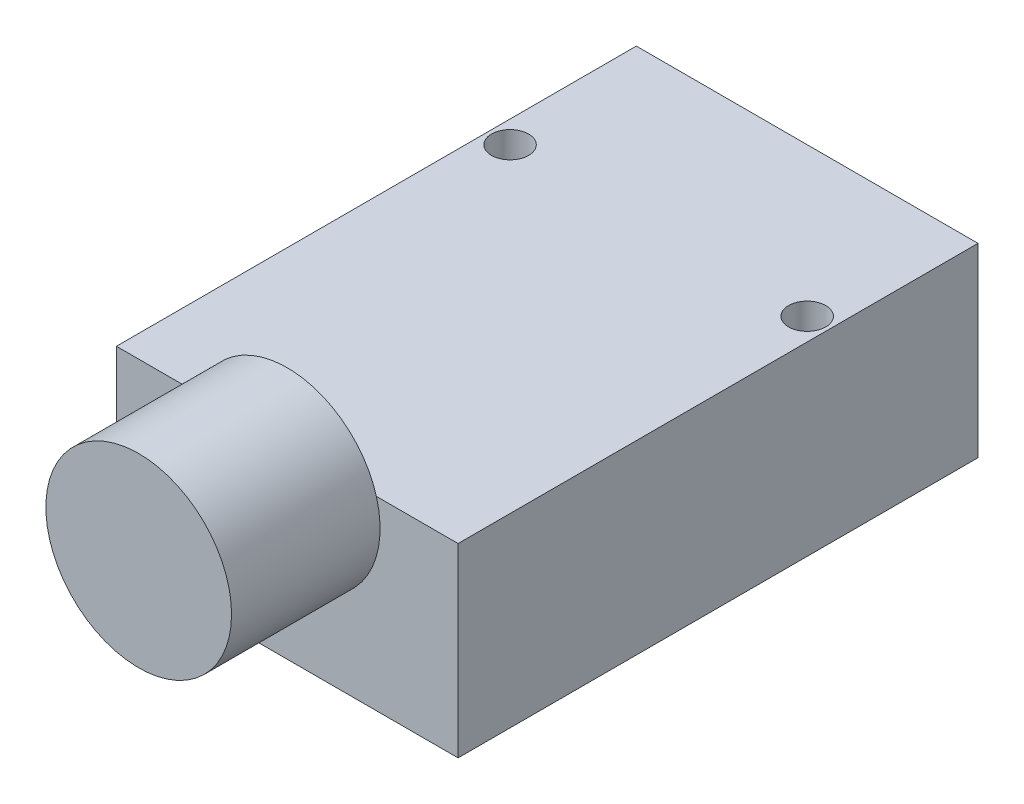
from build123d import *

# Parameters (mm, degrees)
SKETCH1_W           = 46
SKETCH1_H           = 70
BOSS_EXTRUDE1_DEPTH = 25
SKETCH2_R           = 12.5
BOSS_EXTRUDE2_DEPTH = 20
CUT_EXTRUDE1_REACH  = 89.413
SKETCH3_R           = 2.5


with BuildPart() as part:
    # Sketch1 → Boss-Extrude1 (new body)
    with BuildSketch(Plane(origin=(0, 0, 0), x_dir=(1, 0, 0), z_dir=(0, 1, 0))):
        with Locations((23, 35)):
            Rectangle(SKETCH1_W, SKETCH1_H)
    extrude(amount=BOSS_EXTRUDE1_DEPTH)

    # Sketch2 → Boss-Extrude2 (add)
    with BuildSketch(Plane.XY):
        with Locations(Location((23, 21.5, 0), (0, 0, 163.739795292))):
            Circle(SKETCH2_R)
    extrude(amount=BOSS_EXTRUDE2_DEPTH)

    # Sketch3 → Cut-Extrude1 (cut, up to next)
    with BuildSketch(Plane(origin=(0, 25, 0), x_dir=(1, 0, 0), z_dir=(0, 1, 0)), mode=Mode.PRIVATE) as cut_extrude1_sk1:
        with Locations(Location((3, 50, 0), (0, 0, 270))):
            Circle(SKETCH3_R)
    cut_extrude1_tool1 = extrude(cut_extrude1_sk1.sketch, amount=-CUT_EXTRUDE1_REACH, mode=Mode.PRIVATE) & part.part
    # Sketch3 → Cut-Extrude1 (cut, up to next)
    with BuildSketch(Plane(origin=(0, 25, 0), x_dir=(1, 0, 0), z_dir=(0, 1, 0)), mode=Mode.PRIVATE) as cut_extrude1_sk2:
        with Locations(Location((43, 50, 0), (0, 0, 270))):
            Circle(SKETCH3_R)
    cut_extrude1_tool2 = extrude(cut_extrude1_sk2.sketch, amount=-CUT_EXTRUDE1_REACH, mode=Mode.PRIVATE) & part.part
    add(cut_extrude1_tool1.solids().sort_by_distance((3, 25, -50))[0], mode=Mode.SUBTRACT)
    add(cut_extrude1_tool2.solids().sort_by_distance((43, 25, -50))[0], mode=Mode.SUBTRACT)


solid = part.part
